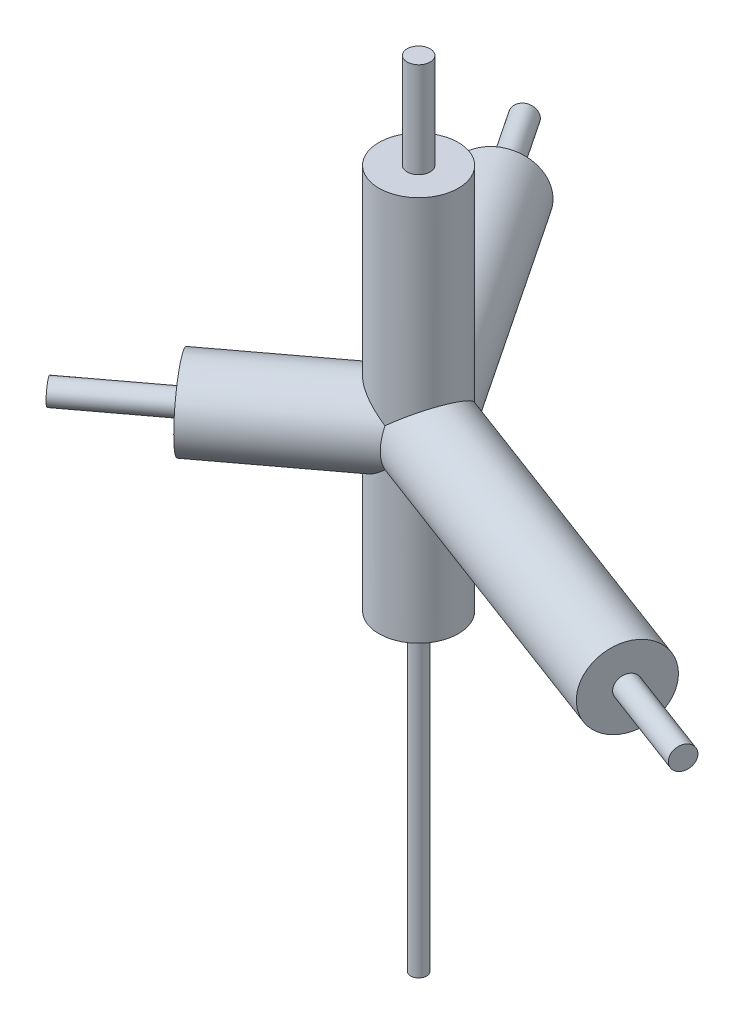
from build123d import *

# Parameters (mm, degrees)
SKETCH_3_R           = 5
SKETCH_4_R           = 5
SKETCH_2_R           = 5
SKETCH_7_R           = 5
SKETCH_7_R_2         = 1.45
CUT_EXTRUDE_1_DEPTH  = 12
SKETCH_8_R           = 5
SKETCH_8_R_2         = 1.45
CUT_EXTRUDE_2_DEPTH  = 12
SKETCH_9_R           = 5
SKETCH_9_R_2         = 1.45
CUT_EXTRUDE_3_DEPTH  = 12
EXTRUDE_1_DEPTH      = 40
EXTRUDE_1_DEPTH_BACK = 60
SKETCH_10_R          = 5
SKETCH_12_R          = 5
SKETCH_12_R_2        = 1.45
CUT_EXTRUDE_5_DEPTH  = 12


with BuildPart() as part:
    # 扫描1: sweep along a path in 草图1
    with BuildLine(Plane(origin=(0, 0, 0), x_dir=(1, 0, 0), z_dir=(0, 1, 0))) as sweep_1_path:
        Line((0, 0), (53.333333333, -20))
    # 草图3 → 扫描1 (sweep)
    with BuildSketch(Plane(origin=(0, 0, 0), x_dir=(0.35112344158838826, 0, -0.9363291775690458), z_dir=(0.9363291775690458, 0, 0.35112344158838826))):
        Circle(SKETCH_3_R)
    sweep(path=sweep_1_path.line)

    # 扫描7: sweep along a path in 草图5
    with BuildLine(Plane(origin=(0, 0, 0), x_dir=(1, 0, 0), z_dir=(0, 1, 0))) as sweep_7_path:
        Line((0, 0), (-26.666666667, 40))
    # 草图4 → 扫描7 (sweep)
    with BuildSketch(Plane(origin=(0, 0, 0), x_dir=(0.8320502943378456, 0, -0.5547001962252264), z_dir=(0.5547001962252264, 0, 0.8320502943378456))):
        Circle(SKETCH_4_R)
    sweep(path=sweep_7_path.line)

    # 扫描8: sweep along a path in 草图6
    with BuildLine(Plane(origin=(0, 0, 0), x_dir=(1, 0, 0), z_dir=(0, 1, 0))) as sweep_8_path:
        Line((0, 0), (-26.666666667, -20))
    # 草图2 → 扫描8 (sweep)
    with BuildSketch(Plane(origin=(0, 0, 0), x_dir=(0.600000000000003, 0, 0.7999999999999979), z_dir=(-0.7999999999999979, 0, 0.600000000000003))):
        Circle(SKETCH_2_R)
    sweep(path=sweep_8_path.line)

    # 草图7 → 切除-拉伸1 (cut)
    with BuildSketch(Plane(origin=(-26.666666667, 0, -40), x_dir=(-0.8320502943378455, 0, 0.5547001962252265), z_dir=(-0.5547001962252265, 0, -0.8320502943378456))):
        Circle(SKETCH_7_R)
        Circle(SKETCH_7_R_2, mode=Mode.SUBTRACT)
    extrude(amount=-CUT_EXTRUDE_1_DEPTH, mode=Mode.SUBTRACT)

    # 草图8 → 切除-拉伸2 (cut)
    with BuildSketch(Plane(origin=(-26.666666667, 0, 20), x_dir=(0.6000000000000031, 0, 0.7999999999999977), z_dir=(-0.7999999999999977, 0, 0.6000000000000031))):
        Circle(SKETCH_8_R)
        Circle(SKETCH_8_R_2, mode=Mode.SUBTRACT)
    extrude(amount=-CUT_EXTRUDE_2_DEPTH, mode=Mode.SUBTRACT)

    # 草图9 → 切除-拉伸3 (cut)
    with BuildSketch(Plane(origin=(53.333333333, 0, 20), x_dir=(0.35112344158838826, 0, -0.9363291775690458), z_dir=(0.9363291775690458, 0, 0.35112344158838826))):
        Circle(SKETCH_9_R)
        Circle(SKETCH_9_R_2, mode=Mode.SUBTRACT)
    extrude(amount=-CUT_EXTRUDE_3_DEPTH, mode=Mode.SUBTRACT)

    # 草图10 → 凸台-拉伸1 (add, two sides: drawn at the far end of the back side and taken through both)
    with BuildSketch(Plane(origin=(0, 0, 0), x_dir=(1, 0, 0), z_dir=(0, 1, 0)).offset(-EXTRUDE_1_DEPTH_BACK)):
        with Locations(Location((0, 0, 0), (0, 0, 270))):
            Circle(SKETCH_10_R)
    extrude(amount=EXTRUDE_1_DEPTH + EXTRUDE_1_DEPTH_BACK)

    # 草图12 → 切除-拉伸5 (cut)
    with BuildSketch(Plane(origin=(0, 40, 0), x_dir=(1, 0, 0), z_dir=(0, 1, 0))):
        with Locations(Location((0, 0, 0), (0, 0, 270))):
            Circle(SKETCH_12_R)
        with Locations(Location((0, 0, 0), (0, 0, 270))):
            Circle(SKETCH_12_R_2, mode=Mode.SUBTRACT)
    extrude(amount=-CUT_EXTRUDE_5_DEPTH, mode=Mode.SUBTRACT)

    # 草图13 → 切除-旋转1 (revolve, cut)
    with BuildSketch(Plane(origin=(0, 0, 0), x_dir=(0, 0, -1), z_dir=(1, 0, 0))):
        with BuildLine():
            Line((-1, -59.017604387), (-1, -20.025015645))
            ThreePointArc((-1, -20.025015645), (-19.897410745, -37.976872316), (-5, -59.364916731))
            Line((-5, -59.364916731), (-5, -59.017604387))
            Line((-5, -59.017604387), (-1, -59.017604387))
        make_face()
        with BuildLine():
            Line((-1, -59.974984355), (-1, -59.017604387))
            Line((-1, -59.017604387), (-5, -59.017604387))
            Line((-5, -59.017604387), (-5, -59.364916731))
            ThreePointArc((-5, -59.364916731), (-3.015467729, -59.771367034), (-1, -59.974984355))
        make_face()
        with BuildLine():
            ThreePointArc((-1, -59.974984355), (-3.015467729, -59.771367034), (-5, -59.364916731))
            Line((-5, -59.364916731), (-5, -60))
            Line((-5, -60), (-1, -60))
            Line((-1, -60), (-1, -59.974984355))
        make_face()
    revolve(axis=Axis((0, -1000, 0), (0, 1, 0)), mode=Mode.SUBTRACT)


solid = part.part
